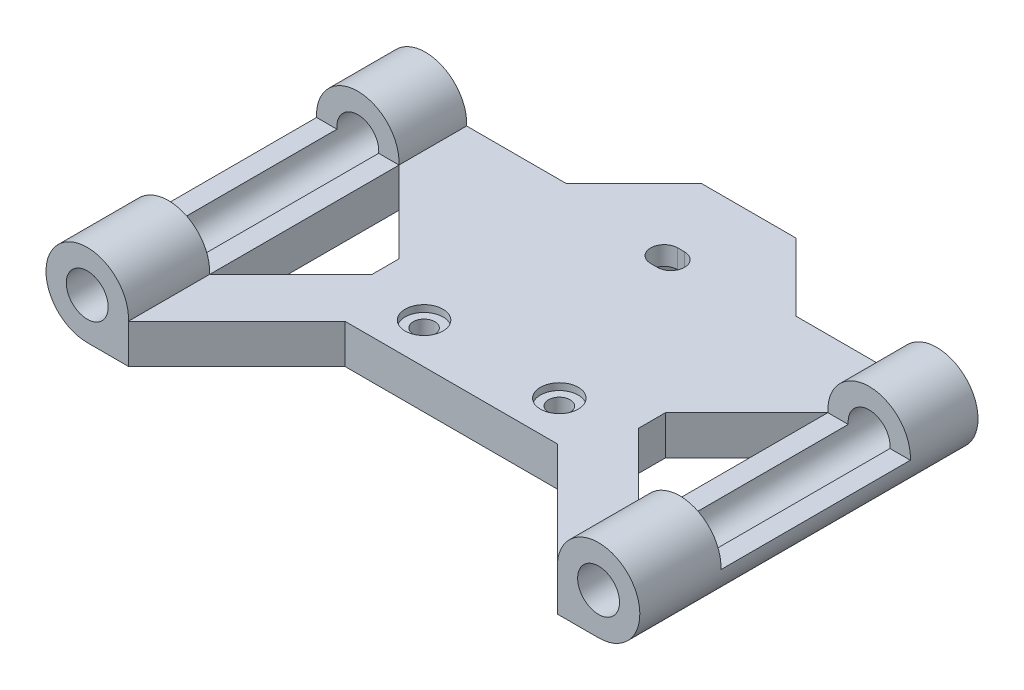
from build123d import *

# Parameters (mm, degrees)
SKETCH_1_R           = 3.05
SKETCH_1_R_2         = 1.55
EXTRUDE_1_DEPTH      = 25
EXTRUDE_2_DEPTH      = 2.895
CUT_EXTRUDE_1_DEPTH  = 56.72379366
CUT_EXTRUDE_START    = -1.5
CUT_EXTRUDE_4_DEPTH  = 1.5
SKETCH_6_R           = 0.8
CUT_EXTRUDE_5_DEPTH  = 56.72379366
CUT_EXTRUDE_6_DEPTH  = 56.72379366
SKETCH_9_W           = 14
SKETCH_9_H           = 3.205
CUT_EXTRUDE_9_DEPTH  = 47.124210282
SKETCH_10_R          = 1.4
CUT_EXTRUDE_11_DEPTH = 0.5


with BuildPart() as part:
    # 草图1 → 凸台-拉伸1 (new body)
    # profile 1 of 3: a face of its own
    with BuildSketch(Plane.XY):
        with Locations((-46.647778168, 5.529205914)):
            Circle(SKETCH_1_R)
        with Locations((-46.647778168, 5.529205914)):
            Circle(SKETCH_1_R_2, mode=Mode.SUBTRACT)
    # profile 2 of 3: a face of its own
    with BuildSketch(Plane.XY):
        with BuildLine():
            ThreePointArc((-43.601719239, 5.374205914), (-44.546617774, 3.318408546), (-46.647778168, 2.479205914))
            Line((-46.647778168, 2.479205914), (-8.847778168, 2.479205914))
            ThreePointArc((-8.847778168, 2.479205914), (-10.948938561, 3.318408546), (-11.893837097, 5.374205914))
            Line((-11.893837097, 5.374205914), (-43.601719239, 5.374205914))
        make_face()
    # profile 3 of 3: a face of its own
    with BuildSketch(Plane.XY):
        with Locations((-8.847778168, 5.529205914)):
            Circle(SKETCH_1_R)
        with Locations((-8.847778168, 5.529205914)):
            Circle(SKETCH_1_R_2, mode=Mode.SUBTRACT)
    extrude(amount=EXTRUDE_1_DEPTH)

    # 草图2 → 凸台-拉伸2 (add)
    with BuildSketch(Plane(origin=(0, 5.374205914, 0), x_dir=(1, 0, 0), z_dir=(0, 1, 0))):
        Polygon((-19.247778168, 0), (-24.247778168, 5), (-31.247778168, 5), (-36.247778168, 0), align=None)
    extrude(amount=-EXTRUDE_2_DEPTH)

    # 草图3 → 切除-拉伸1 (cut, through all)
    with BuildSketch(Plane(origin=(0, 5.374205914, 0), x_dir=(1, 0, 0), z_dir=(0, 1, 0))):
        with BuildLine():
            Line((-27.997778168, 0), (-27.497778168, 0))
            ThreePointArc((-27.497778168, 0), (-26.497778168, -1), (-27.497778168, -2))
            Line((-27.497778168, -2), (-27.997778168, -2))
            ThreePointArc((-27.997778168, -2), (-28.997778168, -1), (-27.997778168, 0))
        make_face()
    extrude(amount=-CUT_EXTRUDE_1_DEPTH, mode=Mode.SUBTRACT)

    # 草图5 → 切除-拉伸4 (cut)
    # profile 1 of 3: a face of its own
    with BuildSketch(Plane(origin=(0, 2.479205914, 0), x_dir=(-1, 0, 0), z_dir=(0, -1, 0)).offset(CUT_EXTRUDE_START)):
        Polygon((25.630642064, -1), (26.814210116, 1.05), (26.314210116, 1.05), (25.130642064, -1), (26.314210116, -3.05), (26.814210116, -3.05), align=None)
    # profile 2 of 3: a face of its own
    with BuildSketch(Plane(origin=(0, 2.479205914, 0), x_dir=(-1, 0, 0), z_dir=(0, -1, 0)).offset(CUT_EXTRUDE_START)):
        Polygon((28.68134622, -3.05), (29.864914271, -1), (28.68134622, 1.05), (26.814210116, 1.05), (25.630642064, -1), (26.814210116, -3.05), align=None)
        with BuildLine():
            ThreePointArc((27.497778168, -2), (26.497778168, -1), (27.497778168, 0))
            Line((27.497778168, 0), (27.997778168, 0))
            ThreePointArc((27.997778168, 0), (28.997778168, -1), (27.997778168, -2))
            Line((27.997778168, -2), (27.497778168, -2))
        make_face(mode=Mode.SUBTRACT)
    # profile 3 of 3: a face of its own
    with BuildSketch(Plane(origin=(0, 2.479205914, 0), x_dir=(-1, 0, 0), z_dir=(0, -1, 0)).offset(CUT_EXTRUDE_START)):
        Polygon((28.68134622, 1.05), (29.864914271, -1), (28.68134622, -3.05), (29.18134622, -3.05), (30.364914271, -1), (29.18134622, 1.05), align=None)
    extrude(amount=CUT_EXTRUDE_4_DEPTH, mode=Mode.SUBTRACT)

    # 草图6 → 切除-拉伸5 (cut, through all)
    with BuildSketch(Plane(origin=(0, 5.374205914, 0), x_dir=(1, 0, 0), z_dir=(0, 1, 0))):
        with Locations(Location((-32.747778168, -14, 0), (0, 0, 270))):
            Circle(SKETCH_6_R)
        with Locations(Location((-22.747778168, -14, 0), (0, 0, 270))):
            Circle(SKETCH_6_R)
    extrude(amount=-CUT_EXTRUDE_5_DEPTH, mode=Mode.SUBTRACT)

    # 草图7 → 切除-拉伸6 (cut, through all)
    with BuildSketch(Plane(origin=(0, 5.374205914, 0), x_dir=(1, 0, 0), z_dir=(0, 1, 0))):
        Polygon((-35.597778168, -17), (-43.597778168, -25), (-11.893837097, -25), (-19.893837097, -17), align=None)
        Polygon((-37.597778168, -13), (-37.597778168, -11), (-43.597778168, -5), (-43.597778168, -19), align=None)
        Polygon((-11.897778168, -5), (-17.897778168, -11), (-17.897778168, -13), (-11.897778168, -19), align=None)
    extrude(amount=-CUT_EXTRUDE_6_DEPTH, mode=Mode.SUBTRACT)

    # 草图9 → 切除-拉伸9 (cut, through all)
    with BuildSketch(Plane.ZY.offset(11.897778168)):
        with Locations((12, 6.976705914)):
            Rectangle(SKETCH_9_W, SKETCH_9_H)
    cut_extrude_9 = extrude(amount=-CUT_EXTRUDE_9_DEPTH, mode=Mode.SUBTRACT)

    # 镜向1: 切除-拉伸9 across plane
    add(cut_extrude_9.mirror(Plane(origin=(-27.747778168, 0, 0), x_dir=(0, 0, 1), z_dir=(1, 0, 0))), mode=Mode.SUBTRACT)

    # 草图10 → 切除-拉伸11 (cut)
    with BuildSketch(Plane(origin=(0, 5.374205914, 0), x_dir=(1, 0, 0), z_dir=(0, 1, 0))):
        with Locations(Location((-22.747778168, -14, 0), (0, 0, 270))):
            Circle(SKETCH_10_R)
        with Locations(Location((-32.747778168, -14, 0), (0, 0, 270))):
            Circle(SKETCH_10_R)
    extrude(amount=-CUT_EXTRUDE_11_DEPTH, mode=Mode.SUBTRACT)


solid = part.part
